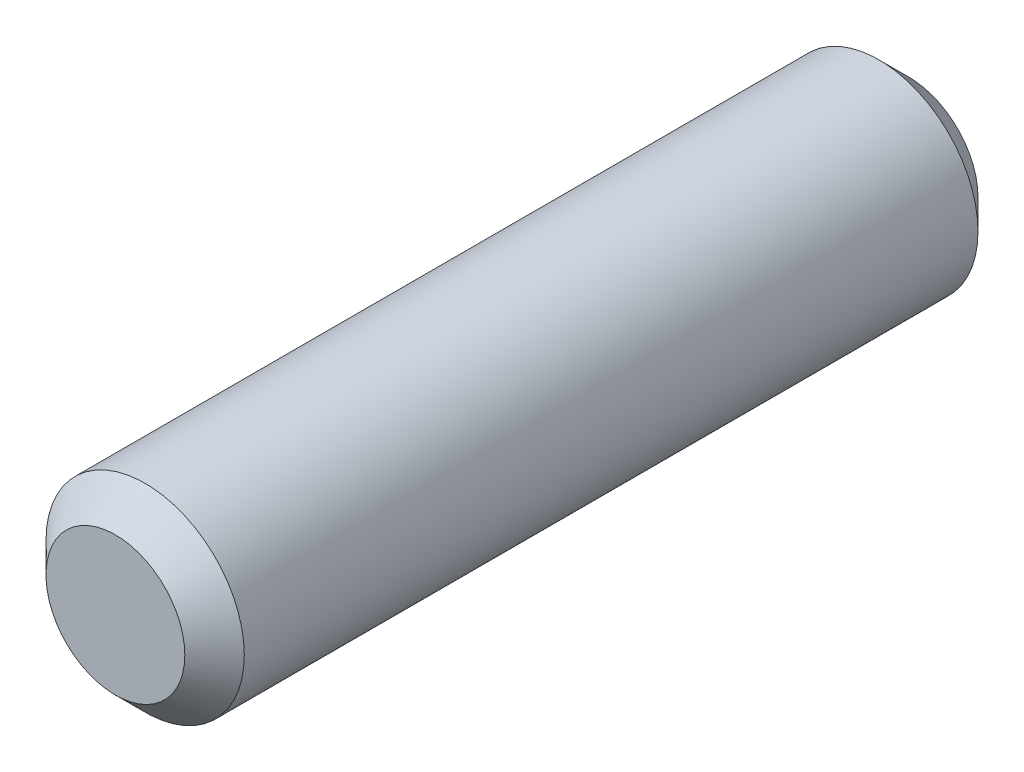
from build123d import *

# Parameters (mm, degrees)
SKETCH_1_R      = 2.5
EXTRUDE_1_DEPTH = 20
CHAMFER_1_SIZE  = 0.75


with BuildPart() as part:
    # Эскиз1 → Бобышка-Вытянуть1 (new body)
    with BuildSketch(Plane.XY):
        Circle(SKETCH_1_R)
    extrude(amount=EXTRUDE_1_DEPTH)

    # Фаска1
    chamfer_1_edges = [part.edges().sort_by_distance(p)[0] for p in [
        (-2.5, 0, 20),
        (-2.5, 0, 0),
    ]]
    chamfer(chamfer_1_edges, length=CHAMFER_1_SIZE)


solid = part.part
